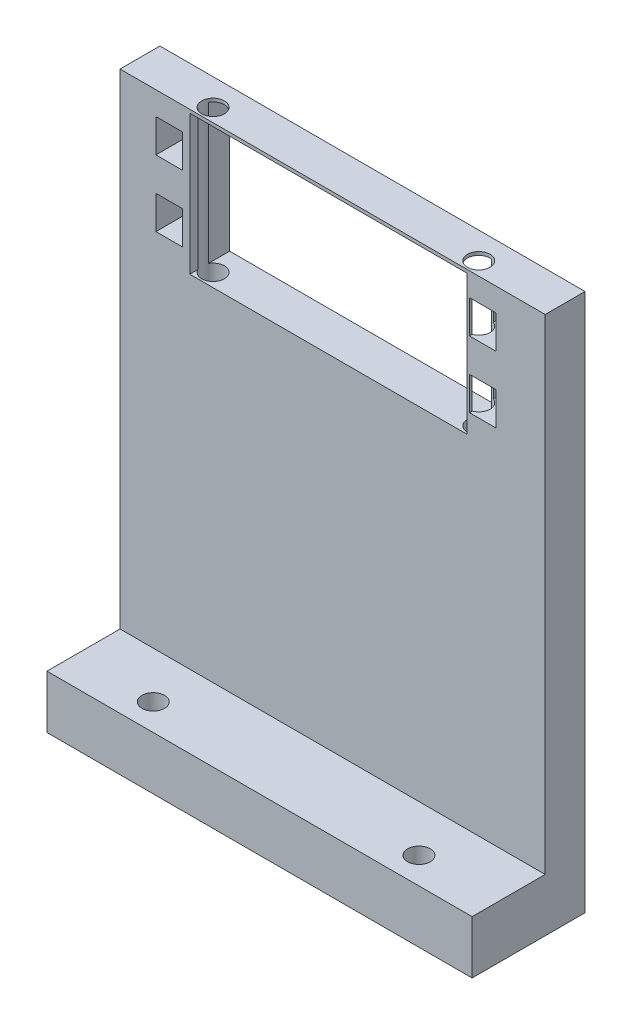
from build123d import *

# Parameters (mm, degrees)
SKETCH_1_W                                      = 64
SKETCH_1_H                                      = 8
SERVO_FOOT_DEPTH                                = 17
SKETCH_2_W                                      = 64
SKETCH_2_H                                      = 81
SERVO_FACE_PLATE_DEPTH                          = 6
MG995_BODY_WINDOW_REFERENCE_DEPTH               = 94.268429814
MG995_BODY_WINDOW_REFERENCE_DEPTH_BACK          = 94.268429814
SKETCH_3_W                                      = 41.7
SKETCH_3_H                                      = 21
MG995_47P2X10_REFERENCE_SLOTS_VERIFY_DEPTH      = 94.268429814
MG995_47P2X10_REFERENCE_SLOTS_VERIFY_DEPTH_BACK = 94.268429814
SKETCH_4_W                                      = 4
SKETCH_4_H                                      = 5
SERVO_FOOT_M3_DEPTH                             = 94.268429814
SERVO_FOOT_M3_DEPTH_BACK                        = 94.268429814
SKETCH_5_R                                      = 1.7


with BuildPart() as part:
    # 草图1 → Servo_foot (new body)
    with BuildSketch(Plane.XY):
        with Locations((11, 4)):
            Rectangle(SKETCH_1_W, SKETCH_1_H)
    extrude(amount=SERVO_FOOT_DEPTH)

    # 草图2 → Servo_face_plate (add)
    with BuildSketch(Plane.XY):
        with Locations((11, 40.5)):
            Rectangle(SKETCH_2_W, SKETCH_2_H)
    extrude(amount=SERVO_FACE_PLATE_DEPTH)

    # 草图3 → MG995_body_window_REFERENCE (cut, two sides: drawn at the far end of the back side and taken through both)
    with BuildSketch(Plane.XY.offset(-MG995_BODY_WINDOW_REFERENCE_DEPTH_BACK)):
        with Locations((10.35, 70)):
            Rectangle(SKETCH_3_W, SKETCH_3_H)
    extrude(amount=MG995_BODY_WINDOW_REFERENCE_DEPTH + MG995_BODY_WINDOW_REFERENCE_DEPTH_BACK, mode=Mode.SUBTRACT)

    # 草图4 → MG995_47p2x10_reference_slots_VERIFY (cut, two sides: drawn at the far end of the back side and taken through both)
    with BuildSketch(Plane.XY.offset(-MG995_47P2X10_REFERENCE_SLOTS_VERIFY_DEPTH_BACK)):
        with Locations((-13.6, 65)):
            Rectangle(SKETCH_4_W, SKETCH_4_H)
        with Locations((-13.6, 75)):
            Rectangle(SKETCH_4_W, SKETCH_4_H)
        with Locations((33.6, 65)):
            Rectangle(SKETCH_4_W, SKETCH_4_H)
        with Locations((33.6, 75)):
            Rectangle(SKETCH_4_W, SKETCH_4_H)
    extrude(amount=MG995_47P2X10_REFERENCE_SLOTS_VERIFY_DEPTH + MG995_47P2X10_REFERENCE_SLOTS_VERIFY_DEPTH_BACK, mode=Mode.SUBTRACT)

    # 草图5 → Servo_foot_M3 (cut, two sides: drawn at the far end of the back side and taken through both)
    with BuildSketch(Plane(origin=(0, 0, 0), x_dir=(1, 0, 0), z_dir=(0, 1, 0)).offset(-SERVO_FOOT_M3_DEPTH_BACK)):
        with Locations(Location((-9, -4, 0), (0, 0, 270))):
            Circle(SKETCH_5_R)
        with Locations(Location((-9, -13, 0), (0, 0, 270))):
            Circle(SKETCH_5_R)
        with Locations(Location((31, -4, 0), (0, 0, 270))):
            Circle(SKETCH_5_R)
        with Locations(Location((31, -13, 0), (0, 0, 270))):
            Circle(SKETCH_5_R)
    extrude(amount=SERVO_FOOT_M3_DEPTH + SERVO_FOOT_M3_DEPTH_BACK, mode=Mode.SUBTRACT)


solid = part.part
